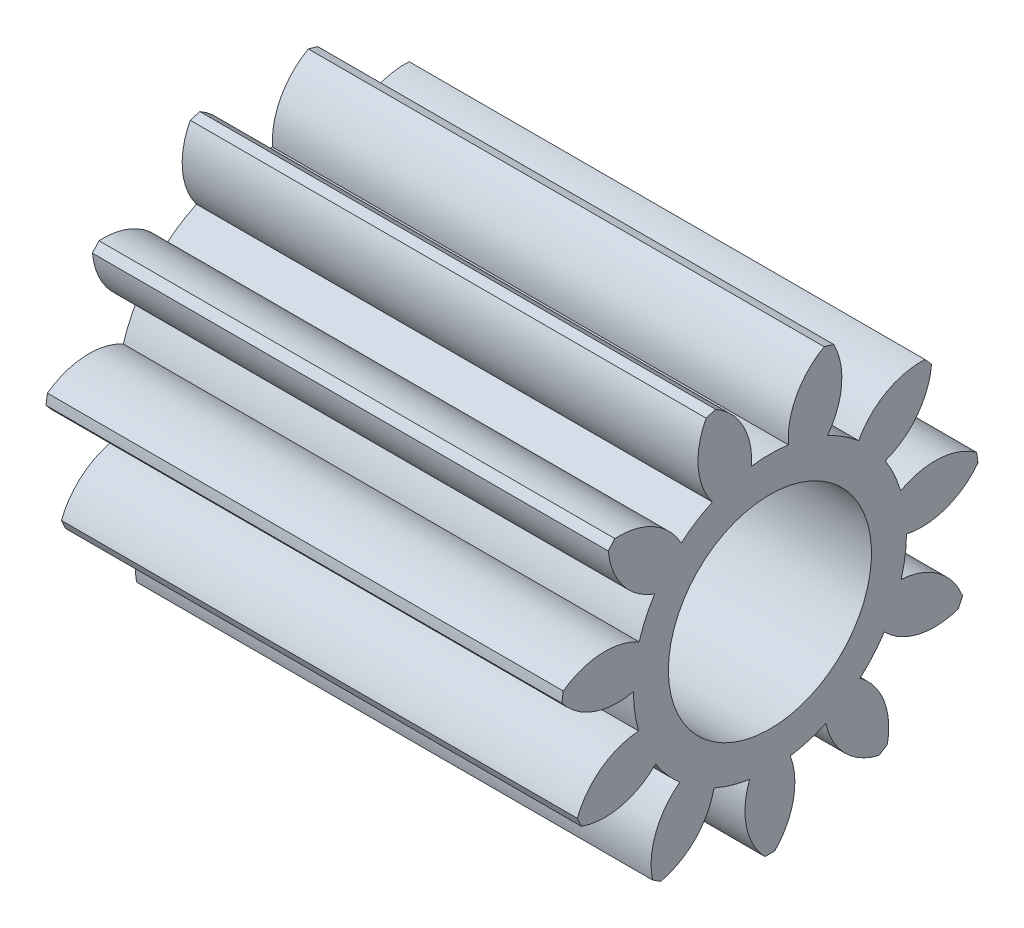
from build123d import *

# Parameters (mm, degrees)
BASPROSKE_W     = 12.7
BASPROSKE_H     = 5.159375
TOOTHCUT_DEPTH  = 15.646784657
TEETHCUTS_COUNT = 11
TEETHCUTS_ANGLE = 327.272727273
BORSKE_R        = 2.499999953
BORE_DEPTH      = 50.8000508


with BuildPart() as part:
    # BasProSke → Base-Revolve (revolve)
    with BuildSketch(Plane(origin=(0, 0, 0), x_dir=(1, 0, 0), z_dir=(0, 1, 0)), mode=Mode.PRIVATE) as base_revolve_sk:
        with Locations((6.35, 2.5796875)):
            Rectangle(BASPROSKE_W, BASPROSKE_H)
    revolve(base_revolve_sk.sketch.rotate(Axis((-10, 0, 0), (1, 0, 0)), 180), axis=Axis((-10, 0, 0), (1, 0, 0)))

    # TooCutSke → ToothCut (cut, through all)
    with BuildSketch(Plane(origin=(0, 0, 0), x_dir=(0, 0, -1), z_dir=(1, 0, 0))):
        with BuildLine():
            ThreePointArc((0.455692995, 3.331302043), (0, 3.362325), (-0.455692995, 3.331302043))
            ThreePointArc((-0.455692995, 3.331302043), (-0.66414347, 4.301321709), (-1.3673759, 5.001217347))
            ThreePointArc((-1.3673759, 5.001217347), (0, 5.184775), (1.3673759, 5.001217347))
            ThreePointArc((1.3673759, 5.001217347), (0.66414347, 4.301321709), (0.455692995, 3.331302043))
        make_face()
    toothcut = extrude(amount=TOOTHCUT_DEPTH, mode=Mode.SUBTRACT)

    # TeethCuts: ToothCut ×11 about axis
    teethcuts_axis = Axis((-10, 0, 0), (1, 0, 0))
    for i in range(1, TEETHCUTS_COUNT):
        add(toothcut.rotate(teethcuts_axis, i * TEETHCUTS_ANGLE / (TEETHCUTS_COUNT - 1)), mode=Mode.SUBTRACT)

    # BorSke → Bore (cut, symmetric)
    with BuildSketch(Plane(origin=(0, 0, 0), x_dir=(0, 0, -1), z_dir=(1, 0, 0))):
        with Locations(Location((0, 0, 0), (0, 0, 180))):
            Circle(BORSKE_R)
    extrude(amount=BORE_DEPTH, both=True, mode=Mode.SUBTRACT)


solid = part.part
